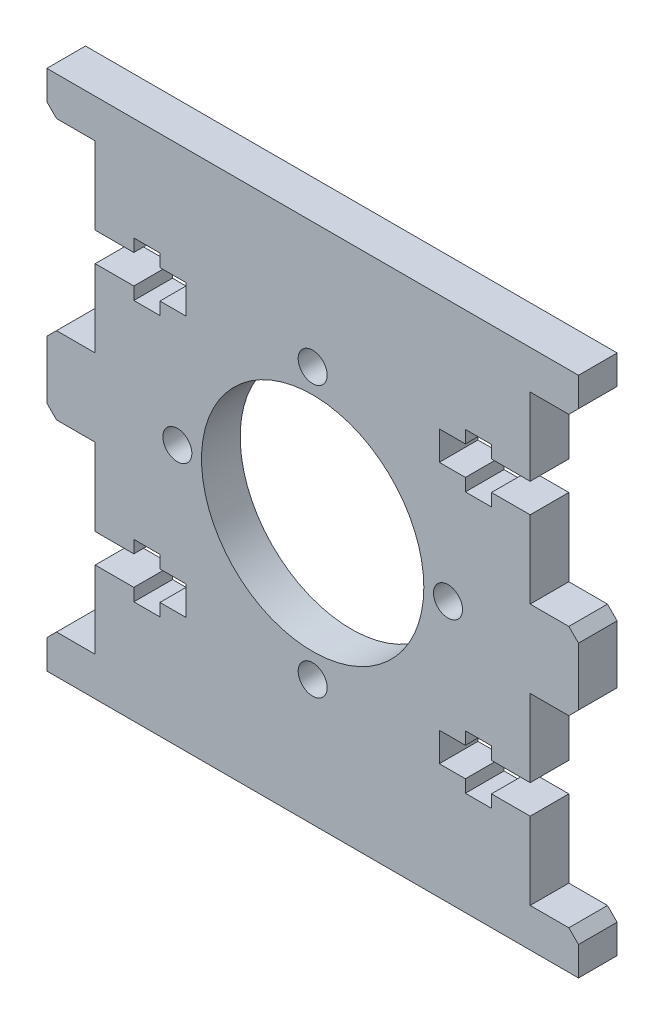
from build123d import *

# Parameters (mm, degrees)
SKETCH_1_R          = 1.5
SKETCH_1_R_2        = 11.5
EXTRUDE_1_DEPTH     = 4
CUT_EXTRUDE_1_DEPTH = 4


with BuildPart() as part:
    # 草图1 → 凸台-拉伸1 (new body)
    with BuildSketch(Plane.XY):
        Polygon((22.5, -27), (-22.5, -27), (-27.5, -27), (-27.5, -23), (-22.5, -23), (-22.5, -15), (-18.5, -15), (-18.5, -16.3), (-15.8, -16.3), (-15.8, -15), (-13.1, -15), (-13.1, -12), (-15.8, -12), (-15.8, -10.7), (-18.5, -10.7), (-18.5, -12), (-22.5, -12), (-22.5, -4), (-27.5, -4), (-27.5, 4), (-22.5, 4), (-22.5, 12), (-18.5, 12), (-18.5, 10.7), (-15.8, 10.7), (-15.8, 12), (-13.1, 12), (-13.1, 15), (-15.8, 15), (-15.8, 16.3), (-18.5, 16.3), (-18.5, 15), (-22.5, 15), (-22.5, 23), (-27.5, 23), (-27.5, 27), (-22.5, 27), (22.5, 27), (27.5, 27), (27.5, 23), (22.5, 23), (22.5, 15), (18.5, 15), (18.5, 16.3), (15.8, 16.3), (15.8, 15), (13.1, 15), (13.1, 12), (15.8, 12), (15.8, 10.7), (18.5, 10.7), (18.5, 12), (22.5, 12), (22.5, 4), (27.5, 4), (27.5, -4), (22.5, -4), (22.5, -12), (18.5, -12), (18.5, -10.7), (15.8, -10.7), (15.8, -12), (13.1, -12), (13.1, -15), (15.8, -15), (15.8, -16.3), (18.5, -16.3), (18.5, -15), (22.5, -15), (22.5, -23), (27.5, -23), (27.5, -27), align=None)
        with Locations((14, 0)):
            Circle(SKETCH_1_R, mode=Mode.SUBTRACT)
        Circle(SKETCH_1_R_2, mode=Mode.SUBTRACT)
        with Locations((0, -14)):
            Circle(SKETCH_1_R, mode=Mode.SUBTRACT)
        with Locations((-14, 0)):
            Circle(SKETCH_1_R, mode=Mode.SUBTRACT)
        with Locations((0, 14)):
            Circle(SKETCH_1_R, mode=Mode.SUBTRACT)
    extrude(amount=EXTRUDE_1_DEPTH)

    # 草图4 → 切除-拉伸1 (cut)
    with BuildSketch(Plane(origin=(0, 0, 0), x_dir=(-1, 0, 0), z_dir=(0, 0, -1))):
        Polygon((-26.5, 4), (-27.5, 3), (-27.5, 4), align=None)
        Polygon((-27.5, -3), (-26.5, -4), (-27.5, -4), align=None)
        Polygon((-27.5, -23), (-26.5, -23), (-27.5, -24), align=None)
        Polygon((-27.5, 24), (-26.5, 23), (-27.5, 23), align=None)
        Polygon((27.5, 23), (27.5, 24), (26.5, 23), align=None)
        Polygon((27.5, -24), (27.5, -23), (26.5, -23), align=None)
        Polygon((27.5, -4), (27.5, -3), (26.5, -4), align=None)
        Polygon((27.5, 4), (26.5, 4), (27.5, 3), align=None)
    extrude(amount=-CUT_EXTRUDE_1_DEPTH, mode=Mode.SUBTRACT)


solid = part.part
